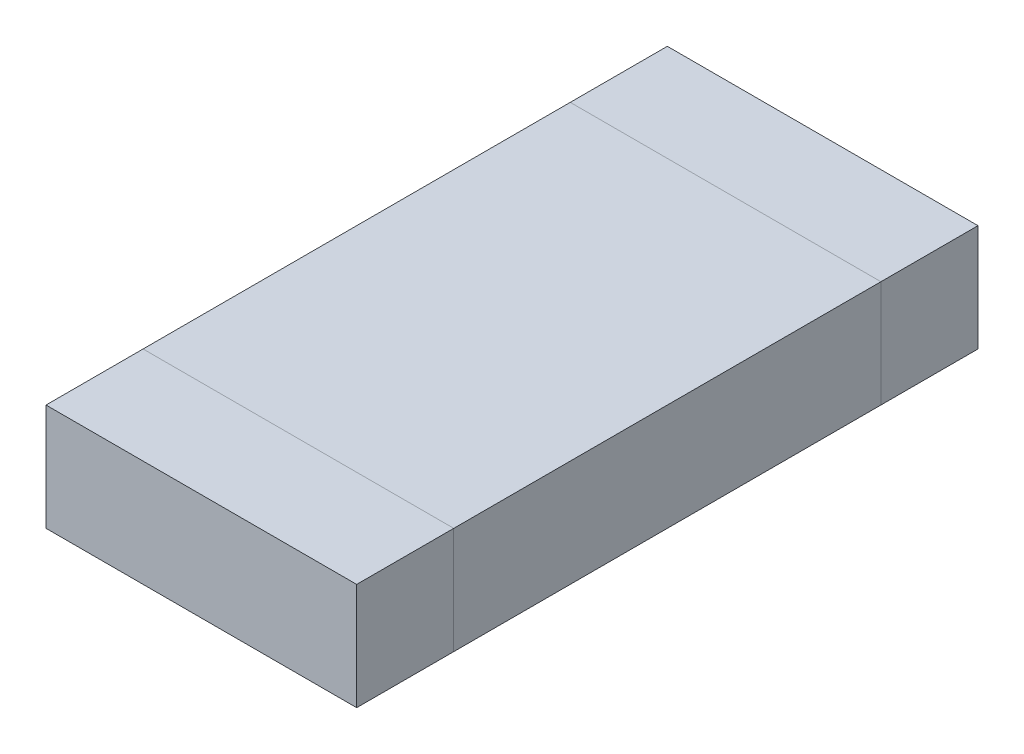
from build123d import *

# Parameters (mm, degrees)
MAINBODYS_W     = 1.6
MAINBODYS_H     = 2.2
MAINBODY_DEPTH  = 0.55
LEFTBODYS_W     = 1.6
LEFTBODYS_H     = 0.5
LEFTBODY_DEPTH  = 0.55
RIGHTBODYS_W    = 1.6
RIGHTBODYS_H    = 0.5
RIGHTBODY_DEPTH = 0.55


with BuildPart() as part:
    # MainBodyS → MainBody (new body)
    with BuildSketch(Plane(origin=(0, 0, 0), x_dir=(1, 0, 0), z_dir=(0, 1, 0))):
        Rectangle(MAINBODYS_W, MAINBODYS_H)
    extrude(amount=MAINBODY_DEPTH)


with BuildPart() as body_2:
    # LeftBodyS → LeftBody (new body)
    with BuildSketch(Plane(origin=(0, 0, 0), x_dir=(-1, 0, 0), z_dir=(0, -1, 0))):
        with Locations((0, -1.35)):
            Rectangle(LEFTBODYS_W, LEFTBODYS_H)
    extrude(amount=-LEFTBODY_DEPTH)


with BuildPart() as body_3:
    # RightBodyS → RightBody (new body)
    with BuildSketch(Plane.XZ):
        with Locations((0, -1.35)):
            Rectangle(RIGHTBODYS_W, RIGHTBODYS_H)
    extrude(amount=-RIGHTBODY_DEPTH)


solid = Compound([part.part, body_2.part, body_3.part])
